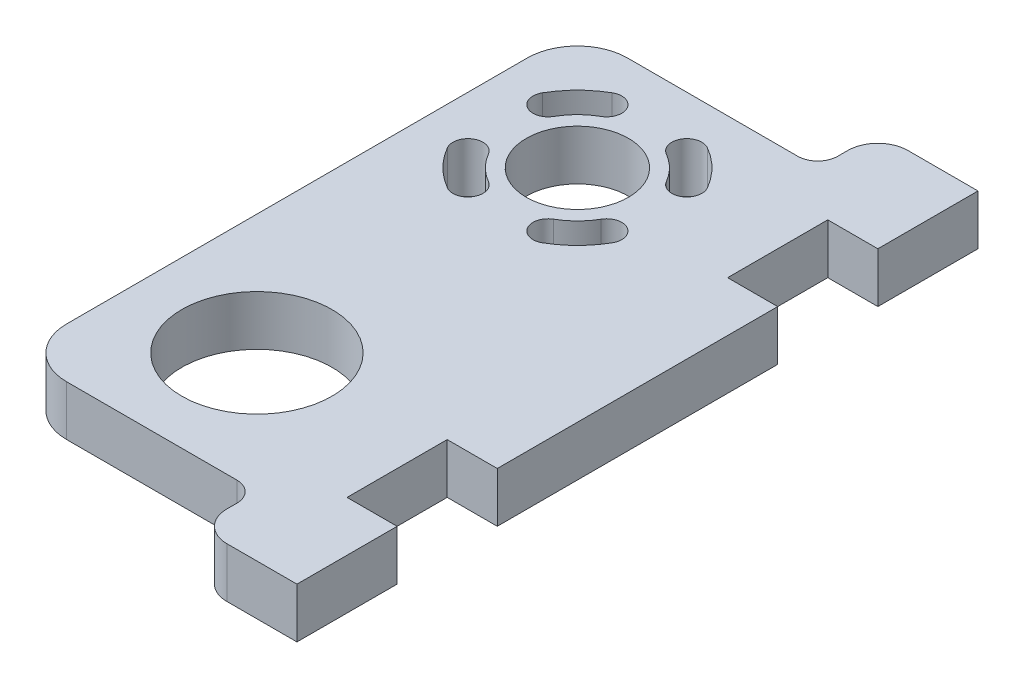
from build123d import *

# Parameters (mm, degrees)
SKETCH_1_R      = 5.1
SKETCH_1_R_2    = 7.5
EXTRUDE_1_DEPTH = 5


with BuildPart() as part:
    # 草图1 → 凸台-拉伸1 (new body)
    with BuildSketch(Plane(origin=(0, 0, 0), x_dir=(1, 0, 0), z_dir=(0, 1, 0))):
        with BuildLine():
            Line((5, 0), (22, 0))
            ThreePointArc((22, 0), (23.414213562, -0.585786438), (24, -2))
            Line((24, -2), (24, -3))
            ThreePointArc((24, -3), (24.878679656, -5.121320344), (27, -6))
            Line((27, -6), (34, -6))
            Line((34, -6), (34, 4))
            Line((34, 4), (29, 4))
            Line((29, 4), (29, 14))
            Line((29, 14), (34, 14))
            Line((34, 14), (34, 42))
            Line((34, 42), (29, 42))
            Line((29, 42), (29, 52))
            Line((29, 52), (34, 52))
            Line((34, 52), (34, 62))
            Line((34, 62), (27, 62))
            ThreePointArc((27, 62), (24.878679656, 61.121320344), (24, 59))
            Line((24, 59), (24, 58))
            ThreePointArc((24, 58), (23.414213562, 56.585786438), (22, 56))
            Line((22, 56), (5, 56))
            ThreePointArc((5, 56), (1.464466094, 54.535533906), (0, 51))
            Line((0, 51), (0, 5))
            ThreePointArc((0, 5), (1.464466094, 1.464466094), (5, 0))
        make_face()
        with Locations(Location((12, 44, 0), (0, 0, 270))):
            Circle(SKETCH_1_R, mode=Mode.SUBTRACT)
        with Locations(Location((12, 12, 0), (0, 0, 270))):
            Circle(SKETCH_1_R_2, mode=Mode.SUBTRACT)
        with BuildLine():
            ThreePointArc((7.25, 52.227241336), (5.282485579, 50.717514421), (3.772758664, 48.75))
            ThreePointArc((3.772758664, 48.75), (4.32179677, 46.700961894), (6.370834875, 47.25))
            ThreePointArc((6.370834875, 47.25), (7.403805922, 48.596194078), (8.75, 49.629165125))
            ThreePointArc((8.75, 49.629165125), (9.299038106, 51.67820323), (7.25, 52.227241336))
        make_face(mode=Mode.SUBTRACT)
        with BuildLine():
            ThreePointArc((20.227241336, 48.75), (18.717514421, 50.717514421), (16.75, 52.227241336))
            ThreePointArc((16.75, 52.227241336), (14.700961894, 51.67820323), (15.25, 49.629165125))
            ThreePointArc((15.25, 49.629165125), (16.596194078, 48.596194078), (17.629165125, 47.25))
            ThreePointArc((17.629165125, 47.25), (19.67820323, 46.700961894), (20.227241336, 48.75))
        make_face(mode=Mode.SUBTRACT)
        with BuildLine():
            ThreePointArc((16.75, 35.772758664), (18.717514421, 37.282485579), (20.227241336, 39.25))
            ThreePointArc((20.227241336, 39.25), (19.67820323, 41.299038106), (17.629165125, 40.75))
            ThreePointArc((17.629165125, 40.75), (16.596194078, 39.403805922), (15.25, 38.370834875))
            ThreePointArc((15.25, 38.370834875), (14.700961894, 36.32179677), (16.75, 35.772758664))
        make_face(mode=Mode.SUBTRACT)
        with BuildLine():
            ThreePointArc((3.772758664, 39.25), (5.282485579, 37.282485579), (7.25, 35.772758664))
            ThreePointArc((7.25, 35.772758664), (9.299038106, 36.32179677), (8.75, 38.370834875))
            ThreePointArc((8.75, 38.370834875), (7.403805922, 39.403805922), (6.370834875, 40.75))
            ThreePointArc((6.370834875, 40.75), (4.32179677, 41.299038106), (3.772758664, 39.25))
        make_face(mode=Mode.SUBTRACT)
    extrude(amount=EXTRUDE_1_DEPTH)


solid = part.part
